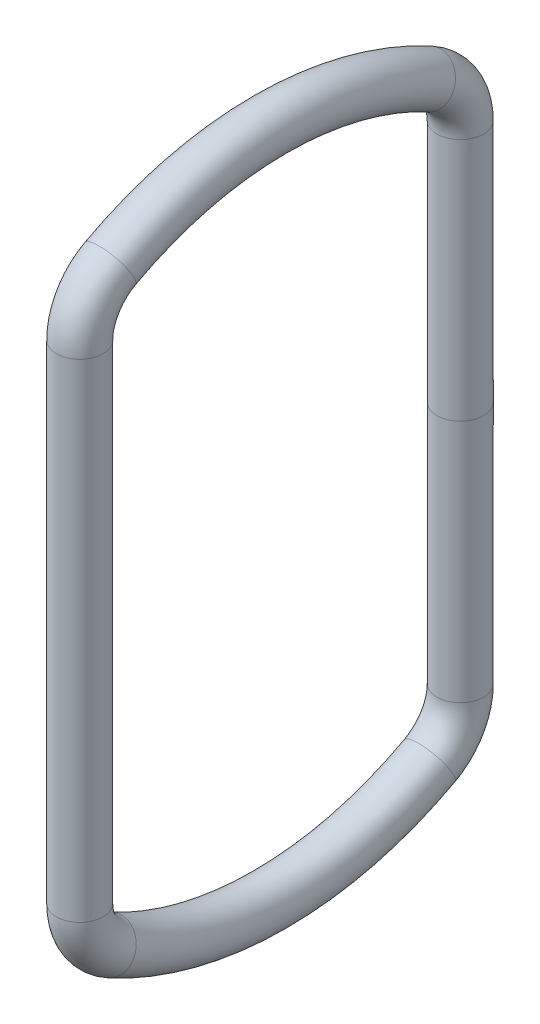
from build123d import *

# Parameters (mm, degrees)
SKETCH2_R = 0.4


with BuildPart() as part:
    # Sweep1: sweep along a path in Sketch1
    with BuildLine(Plane(origin=(0, 0, 0), x_dir=(0, 0, -1), z_dir=(1, 0, 0))) as sweep1_path:
        Line((2.76, 4.177906174), (2.76, -4.177906174))
        ThreePointArc((2.76, -4.177906174), (2.689503998, -4.433887259), (2.497894737, -4.617685771))
        ThreePointArc((2.497894737, -4.617685771), (0, -5.25), (-2.497894737, -4.617685771))
        ThreePointArc((-2.497894737, -4.617685771), (-2.689503998, -4.433887259), (-2.76, -4.177906174))
        Line((-2.76, -4.177906174), (-2.76, 4.177906174))
        ThreePointArc((-2.76, 4.177906174), (-2.689503998, 4.433887259), (-2.497894737, 4.617685771))
        ThreePointArc((-2.497894737, 4.617685771), (0, 5.25), (2.497894737, 4.617685771))
        ThreePointArc((2.497894737, 4.617685771), (2.689503998, 4.433887259), (2.76, 4.177906174))
    # Sketch2 → Sweep1 (sweep)
    with BuildSketch(Plane(origin=(0, 0, 0), x_dir=(1, 0, 0), z_dir=(0, 1, 0))):
        with Locations((0, 3.26)):
            Circle(SKETCH2_R)
    sweep(path=sweep1_path.line)


solid = part.part
